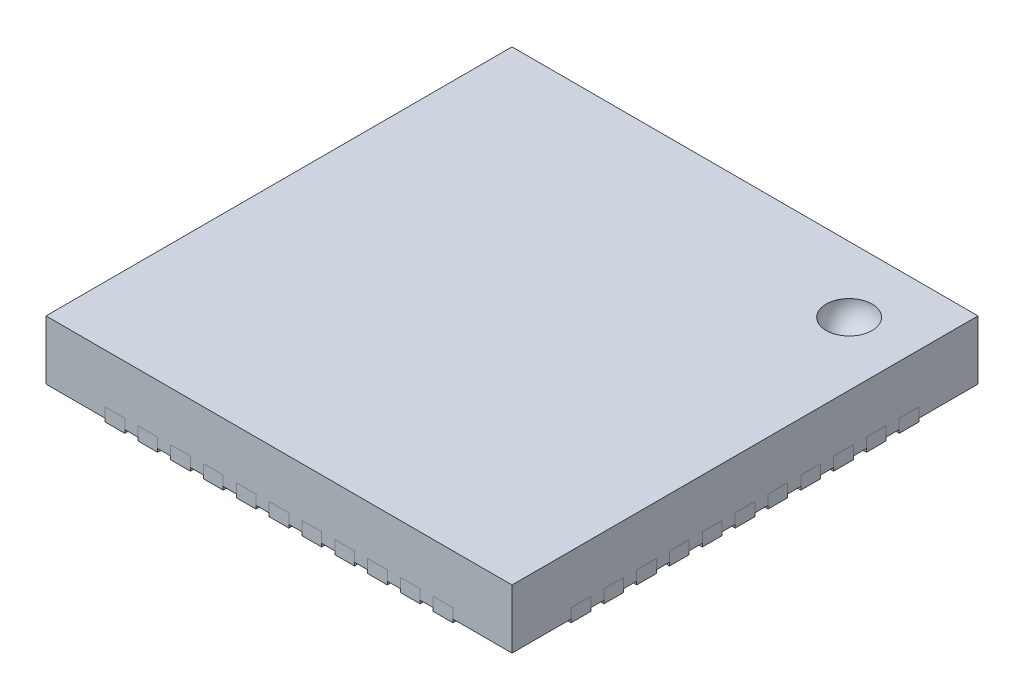
from build123d import *

# Parameters (mm, degrees)
CROQUIS1_W     = 7.1
CROQUIS1_H     = 7.1
EXTRUIR1_DEPTH = 1
EXTRUIR2_REACH = 12.091
CROQUIS2_W     = 7.1
CROQUIS2_H     = 0.1
EXTRUIR3_DEPTH = 0.15
EXTRUIR5_DEPTH = 0.2
MATRIZL1_COUNT = 11
MATRIZL1_PITCH = 0.5
EXTRUIR6_DEPTH = 0.2
MATRIZL2_COUNT = 11
MATRIZL2_PITCH = 0.5
EXTRUIR8_START = 0.2
EXTRUIR8_DEPTH = 0.2


with BuildPart() as part:
    # Croquis1 → Extruir1 (new body)
    with BuildSketch(Plane(origin=(0, 0, 0), x_dir=(1, 0, 0), z_dir=(0, 1, 0))):
        with Locations((3.55, 3.55)):
            Rectangle(CROQUIS1_W, CROQUIS1_H)
    extrude(amount=EXTRUIR1_DEPTH)

    # Croquis2 → Extruir2 (cut, up to next)
    with BuildSketch(Plane.XY, mode=Mode.PRIVATE) as extruir2_sk1:
        with Locations((3.55, 0.05)):
            Rectangle(CROQUIS2_W, CROQUIS2_H)
    extruir2_tool1 = extrude(extruir2_sk1.sketch, amount=-EXTRUIR2_REACH, mode=Mode.PRIVATE) & part.part
    add(extruir2_tool1.solids().sort_by_distance((3.55, 0.05, 0))[0], mode=Mode.SUBTRACT)

    # Croquis3 → Extruir3 (cut)
    with BuildSketch(Plane.XZ.offset(-0.1)):
        with BuildLine():
            Line((3.7, 0), (3.4, 0))
            Line((3.4, 0), (3.4, -0.54))
            ThreePointArc((3.4, -0.54), (3.55, -0.69), (3.7, -0.54))
            Line((3.7, -0.54), (3.7, 0))
        make_face()
        with BuildLine():
            Line((5.95, -0.85), (1.15, -0.85))
            ThreePointArc((1.15, -0.85), (0.937867966, -0.937867966), (0.85, -1.15))
            Line((0.85, -1.15), (0.85, -5.95))
            ThreePointArc((0.85, -5.95), (0.937867966, -6.162132034), (1.15, -6.25))
            Line((1.15, -6.25), (5.95, -6.25))
            ThreePointArc((5.95, -6.25), (6.162132034, -6.162132034), (6.25, -5.95))
            Line((6.25, -5.95), (6.25, -1.15))
            ThreePointArc((6.25, -1.15), (6.162132034, -0.937867966), (5.95, -0.85))
        make_face()
        with BuildLine():
            Line((2.9, 0), (3.2, 0))
            Line((3.2, 0), (3.2, -0.54))
            ThreePointArc((3.2, -0.54), (3.05, -0.69), (2.9, -0.54))
            Line((2.9, -0.54), (2.9, 0))
        make_face()
        with BuildLine():
            Line((2.4, 0), (2.7, 0))
            Line((2.7, 0), (2.7, -0.54))
            ThreePointArc((2.7, -0.54), (2.55, -0.69), (2.4, -0.54))
            Line((2.4, -0.54), (2.4, 0))
        make_face()
        with BuildLine():
            Line((1.9, 0), (2.2, 0))
            Line((2.2, 0), (2.2, -0.54))
            ThreePointArc((2.2, -0.54), (2.05, -0.69), (1.9, -0.54))
            Line((1.9, -0.54), (1.9, 0))
        make_face()
        with BuildLine():
            Line((1.4, 0), (1.7, 0))
            Line((1.7, 0), (1.7, -0.54))
            ThreePointArc((1.7, -0.54), (1.55, -0.69), (1.4, -0.54))
            Line((1.4, -0.54), (1.4, 0))
        make_face()
        with BuildLine():
            Line((0.9, 0), (1.2, 0))
            Line((1.2, 0), (1.2, -0.54))
            ThreePointArc((1.2, -0.54), (1.05, -0.69), (0.9, -0.54))
            Line((0.9, -0.54), (0.9, 0))
        make_face()
        with BuildLine():
            Line((6.2, 0), (6.2, -0.54))
            ThreePointArc((6.2, -0.54), (6.05, -0.69), (5.9, -0.54))
            Line((5.9, -0.54), (5.9, 0))
            Line((5.9, 0), (6.2, 0))
        make_face()
        with BuildLine():
            Line((5.7, 0), (5.7, -0.54))
            ThreePointArc((5.7, -0.54), (5.55, -0.69), (5.4, -0.54))
            Line((5.4, -0.54), (5.4, 0))
            Line((5.4, 0), (5.7, 0))
        make_face()
        with BuildLine():
            Line((5.2, 0), (5.2, -0.54))
            ThreePointArc((5.2, -0.54), (5.05, -0.69), (4.9, -0.54))
            Line((4.9, -0.54), (4.9, 0))
            Line((4.9, 0), (5.2, 0))
        make_face()
        with BuildLine():
            Line((4.7, 0), (4.7, -0.54))
            ThreePointArc((4.7, -0.54), (4.55, -0.69), (4.4, -0.54))
            Line((4.4, -0.54), (4.4, 0))
            Line((4.4, 0), (4.7, 0))
        make_face()
        with BuildLine():
            Line((4.2, 0), (4.2, -0.54))
            ThreePointArc((4.2, -0.54), (4.05, -0.69), (3.9, -0.54))
            Line((3.9, -0.54), (3.9, 0))
            Line((3.9, 0), (4.2, 0))
        make_face()
        with BuildLine():
            Line((7.1, -3.7), (7.1, -3.4))
            Line((7.1, -3.4), (6.56, -3.4))
            ThreePointArc((6.56, -3.4), (6.41, -3.55), (6.56, -3.7))
            Line((6.56, -3.7), (7.1, -3.7))
        make_face()
        with BuildLine():
            Line((7.1, -2.9), (7.1, -3.2))
            Line((7.1, -3.2), (6.56, -3.2))
            ThreePointArc((6.56, -3.2), (6.41, -3.05), (6.56, -2.9))
            Line((6.56, -2.9), (7.1, -2.9))
        make_face()
        with BuildLine():
            Line((7.1, -2.4), (7.1, -2.7))
            Line((7.1, -2.7), (6.56, -2.7))
            ThreePointArc((6.56, -2.7), (6.41, -2.55), (6.56, -2.4))
            Line((6.56, -2.4), (7.1, -2.4))
        make_face()
        with BuildLine():
            Line((7.1, -1.9), (7.1, -2.2))
            Line((7.1, -2.2), (6.56, -2.2))
            ThreePointArc((6.56, -2.2), (6.41, -2.05), (6.56, -1.9))
            Line((6.56, -1.9), (7.1, -1.9))
        make_face()
        with BuildLine():
            Line((7.1, -1.4), (7.1, -1.7))
            Line((7.1, -1.7), (6.56, -1.7))
            ThreePointArc((6.56, -1.7), (6.41, -1.55), (6.56, -1.4))
            Line((6.56, -1.4), (7.1, -1.4))
        make_face()
        with BuildLine():
            Line((7.1, -0.9), (7.1, -1.2))
            Line((7.1, -1.2), (6.56, -1.2))
            ThreePointArc((6.56, -1.2), (6.41, -1.05), (6.56, -0.9))
            Line((6.56, -0.9), (7.1, -0.9))
        make_face()
        with BuildLine():
            Line((7.1, -6.2), (6.56, -6.2))
            ThreePointArc((6.56, -6.2), (6.41, -6.05), (6.56, -5.9))
            Line((6.56, -5.9), (7.1, -5.9))
            Line((7.1, -5.9), (7.1, -6.2))
        make_face()
        with BuildLine():
            Line((7.1, -5.7), (6.56, -5.7))
            ThreePointArc((6.56, -5.7), (6.41, -5.55), (6.56, -5.4))
            Line((6.56, -5.4), (7.1, -5.4))
            Line((7.1, -5.4), (7.1, -5.7))
        make_face()
        with BuildLine():
            Line((7.1, -5.2), (6.56, -5.2))
            ThreePointArc((6.56, -5.2), (6.41, -5.05), (6.56, -4.9))
            Line((6.56, -4.9), (7.1, -4.9))
            Line((7.1, -4.9), (7.1, -5.2))
        make_face()
        with BuildLine():
            Line((7.1, -4.7), (6.56, -4.7))
            ThreePointArc((6.56, -4.7), (6.41, -4.55), (6.56, -4.4))
            Line((6.56, -4.4), (7.1, -4.4))
            Line((7.1, -4.4), (7.1, -4.7))
        make_face()
        with BuildLine():
            Line((7.1, -4.2), (6.56, -4.2))
            ThreePointArc((6.56, -4.2), (6.41, -4.05), (6.56, -3.9))
            Line((6.56, -3.9), (7.1, -3.9))
            Line((7.1, -3.9), (7.1, -4.2))
        make_face()
        with BuildLine():
            Line((3.4, -7.1), (3.7, -7.1))
            Line((3.7, -7.1), (3.7, -6.56))
            ThreePointArc((3.7, -6.56), (3.55, -6.41), (3.4, -6.56))
            Line((3.4, -6.56), (3.4, -7.1))
        make_face()
        with BuildLine():
            Line((4.2, -7.1), (3.9, -7.1))
            Line((3.9, -7.1), (3.9, -6.56))
            ThreePointArc((3.9, -6.56), (4.05, -6.41), (4.2, -6.56))
            Line((4.2, -6.56), (4.2, -7.1))
        make_face()
        with BuildLine():
            Line((4.7, -7.1), (4.4, -7.1))
            Line((4.4, -7.1), (4.4, -6.56))
            ThreePointArc((4.4, -6.56), (4.55, -6.41), (4.7, -6.56))
            Line((4.7, -6.56), (4.7, -7.1))
        make_face()
        with BuildLine():
            Line((5.2, -7.1), (4.9, -7.1))
            Line((4.9, -7.1), (4.9, -6.56))
            ThreePointArc((4.9, -6.56), (5.05, -6.41), (5.2, -6.56))
            Line((5.2, -6.56), (5.2, -7.1))
        make_face()
        with BuildLine():
            Line((5.7, -7.1), (5.4, -7.1))
            Line((5.4, -7.1), (5.4, -6.56))
            ThreePointArc((5.4, -6.56), (5.55, -6.41), (5.7, -6.56))
            Line((5.7, -6.56), (5.7, -7.1))
        make_face()
        with BuildLine():
            Line((6.2, -7.1), (5.9, -7.1))
            Line((5.9, -7.1), (5.9, -6.56))
            ThreePointArc((5.9, -6.56), (6.05, -6.41), (6.2, -6.56))
            Line((6.2, -6.56), (6.2, -7.1))
        make_face()
        with BuildLine():
            Line((0.9, -7.1), (0.9, -6.56))
            ThreePointArc((0.9, -6.56), (1.05, -6.41), (1.2, -6.56))
            Line((1.2, -6.56), (1.2, -7.1))
            Line((1.2, -7.1), (0.9, -7.1))
        make_face()
        with BuildLine():
            Line((1.4, -7.1), (1.4, -6.56))
            ThreePointArc((1.4, -6.56), (1.55, -6.41), (1.7, -6.56))
            Line((1.7, -6.56), (1.7, -7.1))
            Line((1.7, -7.1), (1.4, -7.1))
        make_face()
        with BuildLine():
            Line((1.9, -7.1), (1.9, -6.56))
            ThreePointArc((1.9, -6.56), (2.05, -6.41), (2.2, -6.56))
            Line((2.2, -6.56), (2.2, -7.1))
            Line((2.2, -7.1), (1.9, -7.1))
        make_face()
        with BuildLine():
            Line((2.4, -7.1), (2.4, -6.56))
            ThreePointArc((2.4, -6.56), (2.55, -6.41), (2.7, -6.56))
            Line((2.7, -6.56), (2.7, -7.1))
            Line((2.7, -7.1), (2.4, -7.1))
        make_face()
        with BuildLine():
            Line((2.9, -7.1), (2.9, -6.56))
            ThreePointArc((2.9, -6.56), (3.05, -6.41), (3.2, -6.56))
            Line((3.2, -6.56), (3.2, -7.1))
            Line((3.2, -7.1), (2.9, -7.1))
        make_face()
        with BuildLine():
            Line((0, -3.4), (0, -3.7))
            Line((0, -3.7), (0.54, -3.7))
            ThreePointArc((0.54, -3.7), (0.69, -3.55), (0.54, -3.4))
            Line((0.54, -3.4), (0, -3.4))
        make_face()
        with BuildLine():
            Line((0, -4.2), (0, -3.9))
            Line((0, -3.9), (0.54, -3.9))
            ThreePointArc((0.54, -3.9), (0.69, -4.05), (0.54, -4.2))
            Line((0.54, -4.2), (0, -4.2))
        make_face()
        with BuildLine():
            Line((0, -4.7), (0, -4.4))
            Line((0, -4.4), (0.54, -4.4))
            ThreePointArc((0.54, -4.4), (0.69, -4.55), (0.54, -4.7))
            Line((0.54, -4.7), (0, -4.7))
        make_face()
        with BuildLine():
            Line((0, -5.2), (0, -4.9))
            Line((0, -4.9), (0.54, -4.9))
            ThreePointArc((0.54, -4.9), (0.69, -5.05), (0.54, -5.2))
            Line((0.54, -5.2), (0, -5.2))
        make_face()
        with BuildLine():
            Line((0, -5.7), (0, -5.4))
            Line((0, -5.4), (0.54, -5.4))
            ThreePointArc((0.54, -5.4), (0.69, -5.55), (0.54, -5.7))
            Line((0.54, -5.7), (0, -5.7))
        make_face()
        with BuildLine():
            Line((0, -6.2), (0, -5.9))
            Line((0, -5.9), (0.54, -5.9))
            ThreePointArc((0.54, -5.9), (0.69, -6.05), (0.54, -6.2))
            Line((0.54, -6.2), (0, -6.2))
        make_face()
        with BuildLine():
            Line((0, -0.9), (0.54, -0.9))
            ThreePointArc((0.54, -0.9), (0.69, -1.05), (0.54, -1.2))
            Line((0.54, -1.2), (0, -1.2))
            Line((0, -1.2), (0, -0.9))
        make_face()
        with BuildLine():
            Line((0, -1.4), (0.54, -1.4))
            ThreePointArc((0.54, -1.4), (0.69, -1.55), (0.54, -1.7))
            Line((0.54, -1.7), (0, -1.7))
            Line((0, -1.7), (0, -1.4))
        make_face()
        with BuildLine():
            Line((0, -1.9), (0.54, -1.9))
            ThreePointArc((0.54, -1.9), (0.69, -2.05), (0.54, -2.2))
            Line((0.54, -2.2), (0, -2.2))
            Line((0, -2.2), (0, -1.9))
        make_face()
        with BuildLine():
            Line((0, -2.4), (0.54, -2.4))
            ThreePointArc((0.54, -2.4), (0.69, -2.55), (0.54, -2.7))
            Line((0.54, -2.7), (0, -2.7))
            Line((0, -2.7), (0, -2.4))
        make_face()
        with BuildLine():
            Line((0, -2.9), (0.54, -2.9))
            ThreePointArc((0.54, -2.9), (0.69, -3.05), (0.54, -3.2))
            Line((0.54, -3.2), (0, -3.2))
            Line((0, -3.2), (0, -2.9))
        make_face()
    extrude(amount=-EXTRUIR3_DEPTH, mode=Mode.SUBTRACT)

    # Croquis10 → Cortar-Revolución1 (revolve, cut)
    with BuildSketch(Plane(origin=(0, 1, 0), x_dir=(1, 0, 0), z_dir=(0, 1, 0))):
        with BuildLine():
            Line((6.486658032, 6.1), (5.786658032, 6.1))
            ThreePointArc((5.786658032, 6.1), (6.136658032, 6.45), (6.486658032, 6.1))
        make_face()
    revolve(axis=Axis((6.486658032, 1, -6.1), (-1, 0, 0)), mode=Mode.SUBTRACT)

    # Croquis11 → Extruir8 (add)
    with BuildSketch(Plane.XZ.offset(-0.25).offset(EXTRUIR8_START)):
        with BuildLine():
            Line((0.85, -1.15), (0.85, -5.95))
            ThreePointArc((0.85, -5.95), (0.937867966, -6.162132034), (1.15, -6.25))
            Line((1.15, -6.25), (5.95, -6.25))
            ThreePointArc((5.95, -6.25), (6.162132034, -6.162132034), (6.25, -5.95))
            Line((6.25, -5.95), (6.25, -1.15))
            ThreePointArc((6.25, -1.15), (6.162132034, -0.937867966), (5.95, -0.85))
            Line((5.95, -0.85), (1.15, -0.85))
            ThreePointArc((1.15, -0.85), (0.937867966, -0.937867966), (0.85, -1.15))
        make_face()
    extrude(amount=-EXTRUIR8_DEPTH)


with BuildPart() as body_2:
    # Croquis8 → Extruir5 (new body)
    with BuildSketch(Plane.XZ.offset(-0.25)):
        with BuildLine():
            Line((0, -6.2), (0.54, -6.2))
            ThreePointArc((0.54, -6.2), (0.69, -6.05), (0.54, -5.9))
            Line((0.54, -5.9), (0, -5.9))
            Line((0, -5.9), (0, -6.2))
        make_face()
    extrude(amount=EXTRUIR5_DEPTH)


with BuildPart() as matrizl1_1:
    # MatrizL1: pattern copy
    add(body_2.part.moved(Location(Vector(0, 0, 1) * (1 * MATRIZL1_PITCH))))


with BuildPart() as matrizl1_2:
    # MatrizL1: pattern copy
    add(body_2.part.moved(Location(Vector(0, 0, 1) * (2 * MATRIZL1_PITCH))))


with BuildPart() as matrizl1_3:
    # MatrizL1: pattern copy
    add(body_2.part.moved(Location(Vector(0, 0, 1) * (3 * MATRIZL1_PITCH))))


with BuildPart() as matrizl1_4:
    # MatrizL1: pattern copy
    add(body_2.part.moved(Location(Vector(0, 0, 1) * (4 * MATRIZL1_PITCH))))


with BuildPart() as matrizl1_5:
    # MatrizL1: pattern copy
    add(body_2.part.moved(Location(Vector(0, 0, 1) * (5 * MATRIZL1_PITCH))))


with BuildPart() as matrizl1_6:
    # MatrizL1: pattern copy
    add(body_2.part.moved(Location(Vector(0, 0, 1) * (6 * MATRIZL1_PITCH))))


with BuildPart() as matrizl1_7:
    # MatrizL1: pattern copy
    add(body_2.part.moved(Location(Vector(0, 0, 1) * (7 * MATRIZL1_PITCH))))


with BuildPart() as matrizl1_8:
    # MatrizL1: pattern copy
    add(body_2.part.moved(Location(Vector(0, 0, 1) * (8 * MATRIZL1_PITCH))))


with BuildPart() as matrizl1_9:
    # MatrizL1: pattern copy
    add(body_2.part.moved(Location(Vector(0, 0, 1) * (9 * MATRIZL1_PITCH))))


with BuildPart() as matrizl1_10:
    # MatrizL1: pattern copy
    add(body_2.part.moved(Location(Vector(0, 0, 1) * (10 * MATRIZL1_PITCH))))


with BuildPart() as body_13:
    # Croquis9 → Extruir6 (new body)
    with BuildSketch(Plane.XZ.offset(-0.25)):
        with BuildLine():
            Line((0.9, 0), (0.9, -0.54))
            ThreePointArc((0.9, -0.54), (1.05, -0.69), (1.2, -0.54))
            Line((1.2, -0.54), (1.2, 0))
            Line((1.2, 0), (0.9, 0))
        make_face()
    extrude(amount=EXTRUIR6_DEPTH)


with BuildPart() as matrizl2_1:
    # MatrizL2: pattern copy
    add(body_13.part.moved(Location(Vector(1, 0, 0) * (1 * MATRIZL2_PITCH))))


with BuildPart() as matrizl2_2:
    # MatrizL2: pattern copy
    add(body_13.part.moved(Location(Vector(1, 0, 0) * (2 * MATRIZL2_PITCH))))


with BuildPart() as matrizl2_3:
    # MatrizL2: pattern copy
    add(body_13.part.moved(Location(Vector(1, 0, 0) * (3 * MATRIZL2_PITCH))))


with BuildPart() as matrizl2_4:
    # MatrizL2: pattern copy
    add(body_13.part.moved(Location(Vector(1, 0, 0) * (4 * MATRIZL2_PITCH))))


with BuildPart() as matrizl2_5:
    # MatrizL2: pattern copy
    add(body_13.part.moved(Location(Vector(1, 0, 0) * (5 * MATRIZL2_PITCH))))


with BuildPart() as matrizl2_6:
    # MatrizL2: pattern copy
    add(body_13.part.moved(Location(Vector(1, 0, 0) * (6 * MATRIZL2_PITCH))))


with BuildPart() as matrizl2_7:
    # MatrizL2: pattern copy
    add(body_13.part.moved(Location(Vector(1, 0, 0) * (7 * MATRIZL2_PITCH))))


with BuildPart() as matrizl2_8:
    # MatrizL2: pattern copy
    add(body_13.part.moved(Location(Vector(1, 0, 0) * (8 * MATRIZL2_PITCH))))


with BuildPart() as matrizl2_9:
    # MatrizL2: pattern copy
    add(body_13.part.moved(Location(Vector(1, 0, 0) * (9 * MATRIZL2_PITCH))))


with BuildPart() as matrizl2_10:
    # MatrizL2: pattern copy
    add(body_13.part.moved(Location(Vector(1, 0, 0) * (10 * MATRIZL2_PITCH))))


with BuildPart() as body_24:
    # Simetría1: mirrored copy
    add(matrizl1_10.part.mirror(Plane(origin=(3.55, 0.1, -0.85), x_dir=(0, 0, 1), z_dir=(-1, 0, 0))))


with BuildPart() as body_25:
    # Simetr_a1 2: mirrored copy
    add(matrizl1_9.part.mirror(Plane(origin=(3.55, 0.1, -0.85), x_dir=(0, 0, 1), z_dir=(-1, 0, 0))))


with BuildPart() as body_26:
    # Simetr_a1 3: mirrored copy
    add(matrizl1_8.part.mirror(Plane(origin=(3.55, 0.1, -0.85), x_dir=(0, 0, 1), z_dir=(-1, 0, 0))))


with BuildPart() as body_27:
    # Simetr_a1 4: mirrored copy
    add(matrizl1_7.part.mirror(Plane(origin=(3.55, 0.1, -0.85), x_dir=(0, 0, 1), z_dir=(-1, 0, 0))))


with BuildPart() as body_28:
    # Simetr_a1 5: mirrored copy
    add(matrizl1_6.part.mirror(Plane(origin=(3.55, 0.1, -0.85), x_dir=(0, 0, 1), z_dir=(-1, 0, 0))))


with BuildPart() as body_29:
    # Simetr_a1 6: mirrored copy
    add(matrizl1_5.part.mirror(Plane(origin=(3.55, 0.1, -0.85), x_dir=(0, 0, 1), z_dir=(-1, 0, 0))))


with BuildPart() as body_30:
    # Simetr_a1 7: mirrored copy
    add(matrizl1_4.part.mirror(Plane(origin=(3.55, 0.1, -0.85), x_dir=(0, 0, 1), z_dir=(-1, 0, 0))))


with BuildPart() as body_31:
    # Simetr_a1 8: mirrored copy
    add(matrizl1_3.part.mirror(Plane(origin=(3.55, 0.1, -0.85), x_dir=(0, 0, 1), z_dir=(-1, 0, 0))))


with BuildPart() as body_32:
    # Simetr_a1 9: mirrored copy
    add(matrizl1_2.part.mirror(Plane(origin=(3.55, 0.1, -0.85), x_dir=(0, 0, 1), z_dir=(-1, 0, 0))))


with BuildPart() as body_33:
    # Simetr_a1 10: mirrored copy
    add(matrizl1_1.part.mirror(Plane(origin=(3.55, 0.1, -0.85), x_dir=(0, 0, 1), z_dir=(-1, 0, 0))))


with BuildPart() as body_34:
    # Simetr_a1 11: mirrored copy
    add(body_2.part.mirror(Plane(origin=(3.55, 0.1, -0.85), x_dir=(0, 0, 1), z_dir=(-1, 0, 0))))


with BuildPart() as body_35:
    # Simetría2: mirrored copy
    add(body_13.part.mirror(Plane(origin=(0.85, 0.1, -3.55), x_dir=(1, 0, 0), z_dir=(0, 0, -1))))


with BuildPart() as body_36:
    # Simetr_a2 2: mirrored copy
    add(matrizl2_1.part.mirror(Plane(origin=(0.85, 0.1, -3.55), x_dir=(1, 0, 0), z_dir=(0, 0, -1))))


with BuildPart() as body_37:
    # Simetr_a2 3: mirrored copy
    add(matrizl2_2.part.mirror(Plane(origin=(0.85, 0.1, -3.55), x_dir=(1, 0, 0), z_dir=(0, 0, -1))))


with BuildPart() as body_38:
    # Simetr_a2 4: mirrored copy
    add(matrizl2_3.part.mirror(Plane(origin=(0.85, 0.1, -3.55), x_dir=(1, 0, 0), z_dir=(0, 0, -1))))


with BuildPart() as body_39:
    # Simetr_a2 5: mirrored copy
    add(matrizl2_4.part.mirror(Plane(origin=(0.85, 0.1, -3.55), x_dir=(1, 0, 0), z_dir=(0, 0, -1))))


with BuildPart() as body_40:
    # Simetr_a2 6: mirrored copy
    add(matrizl2_5.part.mirror(Plane(origin=(0.85, 0.1, -3.55), x_dir=(1, 0, 0), z_dir=(0, 0, -1))))


with BuildPart() as body_41:
    # Simetr_a2 7: mirrored copy
    add(matrizl2_6.part.mirror(Plane(origin=(0.85, 0.1, -3.55), x_dir=(1, 0, 0), z_dir=(0, 0, -1))))


with BuildPart() as body_42:
    # Simetr_a2 8: mirrored copy
    add(matrizl2_7.part.mirror(Plane(origin=(0.85, 0.1, -3.55), x_dir=(1, 0, 0), z_dir=(0, 0, -1))))


with BuildPart() as body_43:
    # Simetr_a2 9: mirrored copy
    add(matrizl2_8.part.mirror(Plane(origin=(0.85, 0.1, -3.55), x_dir=(1, 0, 0), z_dir=(0, 0, -1))))


with BuildPart() as body_44:
    # Simetr_a2 10: mirrored copy
    add(matrizl2_9.part.mirror(Plane(origin=(0.85, 0.1, -3.55), x_dir=(1, 0, 0), z_dir=(0, 0, -1))))


with BuildPart() as body_45:
    # Simetr_a2 11: mirrored copy
    add(matrizl2_10.part.mirror(Plane(origin=(0.85, 0.1, -3.55), x_dir=(1, 0, 0), z_dir=(0, 0, -1))))


solid = Compound([part.part, body_2.part, matrizl1_1.part, matrizl1_2.part, matrizl1_3.part, matrizl1_4.part, matrizl1_5.part, matrizl1_6.part, matrizl1_7.part, matrizl1_8.part, matrizl1_9.part, matrizl1_10.part, body_13.part, matrizl2_1.part, matrizl2_2.part, matrizl2_3.part, matrizl2_4.part, matrizl2_5.part, matrizl2_6.part, matrizl2_7.part, matrizl2_8.part, matrizl2_9.part, matrizl2_10.part, body_24.part, body_25.part, body_26.part, body_27.part, body_28.part, body_29.part, body_30.part, body_31.part, body_32.part, body_33.part, body_34.part, body_35.part, body_36.part, body_37.part, body_38.part, body_39.part, body_40.part, body_41.part, body_42.part, body_43.part, body_44.part, body_45.part])
